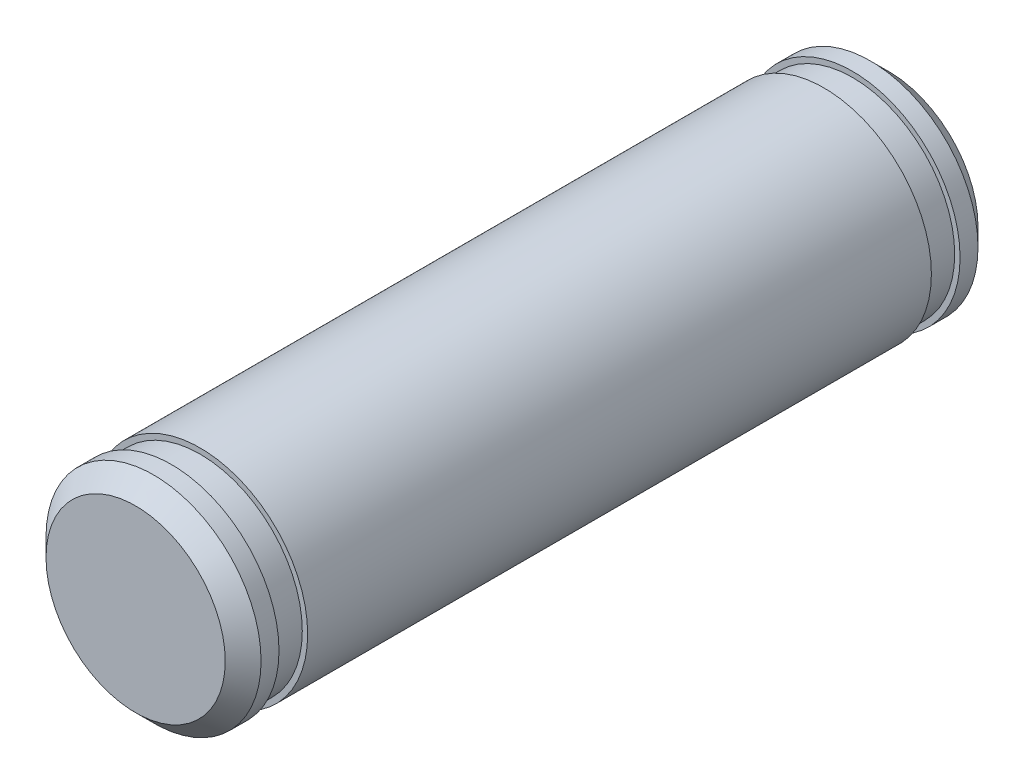
from build123d import *

# Parameters (mm, degrees)
SZKIC1_R                    = 3
DODANIE_WYCI_GNI_CIE1_DEPTH = 21
SFAZOWANIE1_SIZE            = 0.5
WYTNIJ_WYCI_GNI_CIE1_START  = -1.8
SZKIC2_R                    = 3
SZKIC2_R_2                  = 2.85
WYTNIJ_WYCI_GNI_CIE1_DEPTH  = 0.8
WYTNIJ_WYCI_GNI_CIE2_START  = -1
SZKIC3_R                    = 3
SZKIC3_R_2                  = 2.85
WYTNIJ_WYCI_GNI_CIE2_DEPTH  = 0.8


with BuildPart() as part:
    # Szkic1 → Dodanie-wyciągnięcie1 (new body)
    with BuildSketch(Plane.XY):
        with Locations(Location((0, 0, 0), (0, 0, 180))):
            Circle(SZKIC1_R)
    extrude(amount=DODANIE_WYCI_GNI_CIE1_DEPTH)

    # Sfazowanie1
    sfazowanie1_edges = [part.edges().sort_by_distance(p)[0] for p in [
        (3, 0, 0),
        (3, 0, 21),
    ]]
    chamfer(sfazowanie1_edges, length=SFAZOWANIE1_SIZE)

    # Szkic2 → Wytnij-wyciągnięcie1 (cut)
    with BuildSketch(Plane.XY.offset(21).offset(WYTNIJ_WYCI_GNI_CIE1_START)):
        with Locations(Location((0, 0, 0), (0, 0, 180))):
            Circle(SZKIC2_R)
        Circle(SZKIC2_R_2, mode=Mode.SUBTRACT)
    extrude(amount=WYTNIJ_WYCI_GNI_CIE1_DEPTH, mode=Mode.SUBTRACT)

    # Szkic3 → Wytnij-wyciągnięcie2 (cut)
    with BuildSketch(Plane(origin=(0, 0, 0), x_dir=(-1, 0, 0), z_dir=(0, 0, -1)).offset(WYTNIJ_WYCI_GNI_CIE2_START)):
        Circle(SZKIC3_R)
        with Locations(Location((0, 0, 0), (0, 0, 180))):
            Circle(SZKIC3_R_2, mode=Mode.SUBTRACT)
    extrude(amount=-WYTNIJ_WYCI_GNI_CIE2_DEPTH, mode=Mode.SUBTRACT)


solid = part.part
